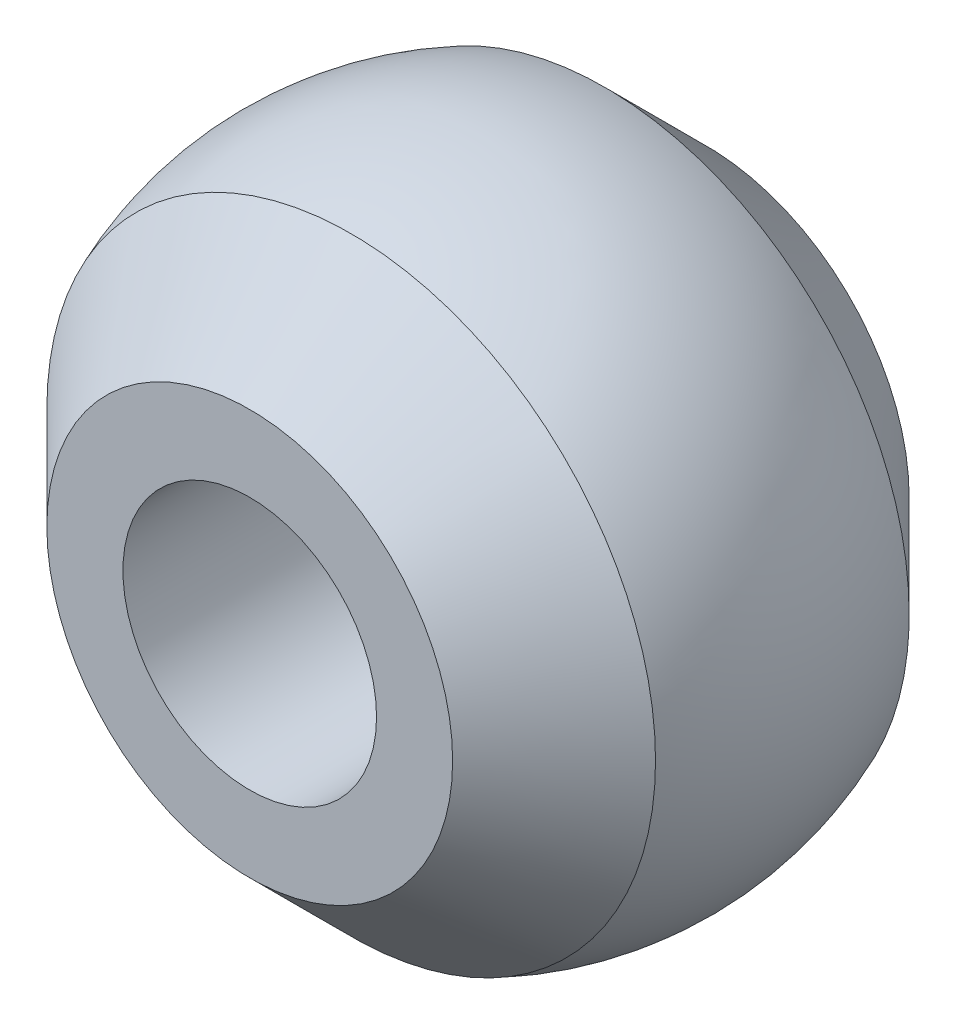
from build123d import *

# Parameters (mm, degrees)
SKETCH_1_R          = 10
EXTRUDE_1_DEPTH     = 4.5
SKETCH_4_R          = 8
EXTRUDE_3_DEPTH     = 5
SKETCH_5_R          = 8
EXTRUDE_4_DEPTH     = 2.5
SKETCH_8_R          = 4
SKETCH_7_R          = 6
SKETCH_9_R          = 14.627232323
SKETCH_9_R_2        = 10
CUT_EXTRUDE_1_DEPTH = 18
SKETCH_10_R         = 2.5
CUT_EXTRUDE_2_DEPTH = 10
SKETCH_2_R          = 6
EXTRUDE_5_DEPTH     = 80
SKETCH_11_W         = 44.642823809
SKETCH_11_H         = 125.571137761
SKETCH_11_R         = 6
CUT_EXTRUDE_3_DEPTH = 18


with BuildPart() as part:
    # 草图1 → 凸台-拉伸1 (new body)
    with BuildSketch(Plane(origin=(0, 0, 0), x_dir=(1, 0, 0), z_dir=(0, 1, 0))):
        with Locations(Location((0, 0, 0), (0, 0, 270))):
            Circle(SKETCH_1_R)
    extrude(amount=EXTRUDE_1_DEPTH)

    # 草图4 → 凸台-拉伸3 (add, symmetric)
    with BuildSketch(Plane.XY):
        with BuildLine():
            Line((-10, 4.5), (10, 4.5))
            Line((10, 4.5), (10, 14.5))
            ThreePointArc((10, 14.5), (0, 24.5), (-10, 14.5))
            Line((-10, 14.5), (-10, 4.5))
        make_face()
        with Locations((0, 14.5)):
            Circle(SKETCH_4_R, mode=Mode.SUBTRACT)
    extrude(amount=EXTRUDE_3_DEPTH, both=True)

    # 草图5 → 凸台-拉伸4 (add, symmetric)
    with BuildSketch(Plane.XY):
        with Locations((0, 14.5)):
            Circle(SKETCH_5_R)
    extrude(amount=EXTRUDE_4_DEPTH, both=True)

    # 草图8 → 放样1 section 0
    with BuildSketch(Plane.XY.offset(4.5)):
        with Locations((0, 14.5)):
            Circle(SKETCH_8_R)
    # 草图7 → 放样1 section 1
    with BuildSketch(Plane.XY.offset(2.5)):
        with Locations((0, 14.5)):
            Circle(SKETCH_7_R)
    loft_1 = loft()

    # 镜向1: 放样1 across plane
    add(loft_1.mirror(Plane.XY))

    # 草图9 → 切除-拉伸1 (cut)
    with BuildSketch(Plane(origin=(0, 4.5, 0), x_dir=(1, 0, 0), z_dir=(0, 1, 0))):
        Circle(SKETCH_9_R)
        with Locations(Location((0, 0, 0), (0, 0, 150))):
            Circle(SKETCH_9_R_2, mode=Mode.SUBTRACT)
    extrude(amount=CUT_EXTRUDE_1_DEPTH, mode=Mode.SUBTRACT)

    # 草图10 → 切除-拉伸2 (cut)
    with BuildSketch(Plane.XY.offset(4.5)):
        with Locations((0, 14.5)):
            Circle(SKETCH_10_R)
    extrude(amount=-CUT_EXTRUDE_2_DEPTH, mode=Mode.SUBTRACT)

    # 草图2 → 凸台-拉伸5 (add)
    with BuildSketch(Plane.XZ):
        with Locations(Location((0, 0, 0), (0, 0, 270))):
            Circle(SKETCH_2_R)
    extrude(amount=EXTRUDE_5_DEPTH)

    # 草图11 → 切除-拉伸3 (cut, symmetric)
    with BuildSketch(Plane.XY.offset(4.5)):
        with Locations((1.10319776, -29.667351992)):
            Rectangle(SKETCH_11_W, SKETCH_11_H)
        with Locations(Location((0, 14.5, 0), (0, 0, 180))):
            Circle(SKETCH_11_R, mode=Mode.SUBTRACT)
    extrude(amount=CUT_EXTRUDE_3_DEPTH, both=True, mode=Mode.SUBTRACT)

    # 草图13 → 旋转2 (revolve)
    with BuildSketch(Plane(origin=(0, 0, 0), x_dir=(0, 0, -1), z_dir=(1, 0, 0)), mode=Mode.PRIVATE) as revolve_2_sk:
        with BuildLine():
            Line((-2.5, 20.5), (2.5, 20.5))
            ThreePointArc((2.5, 20.5), (0, 21), (-2.5, 20.5))
        make_face()
    revolve(revolve_2_sk.sketch.rotate(Axis((0, 14.5, 0), (0, 0, -1)), 270), axis=Axis((0, 14.5, 0), (0, 0, -1)))


solid = part.part
